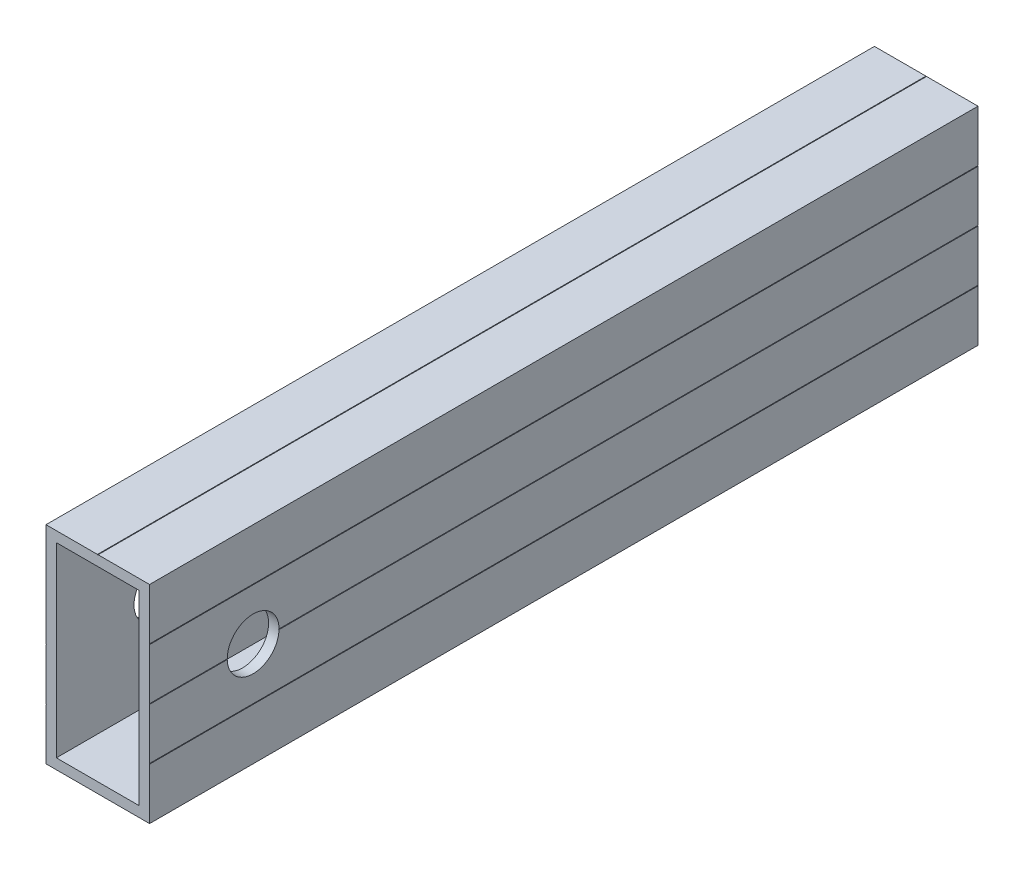
from build123d import *

# Parameters (mm, degrees)
SKETCH1_W           = 1498.6
SKETCH1_H           = 50.8
BOSS_EXTRUDE1_DEPTH = 25.4
CUT_EXTRUDE1_DEPTH  = 1498.6
CUT_EXTRUDE2_DEPTH  = 1499.869043646
CUT_EXTRUDE3_DEPTH  = 1498.6
CUT_EXTRUDE4_DEPTH  = 1498.6
CUT_EXTRUDE5_DEPTH  = 1499.869043646
CUT_EXTRUDE6_DEPTH  = 1499.869043646
CUT_EXTRUDE7_DEPTH  = 1498.6
CUT_EXTRUDE8_DEPTH  = 1498.6
SKETCH10_W          = 20.32
SKETCH10_H          = 45.72
CUT_EXTRUDE9_DEPTH  = 1499.869043646
DRAFT1_ANGLE        = 45
DRAFT2_ANGLE        = 45.000000005
DRAFT3_ANGLE        = 45
DRAFT4_ANGLE        = 45
DRAFT5_ANGLE        = 45
DRAFT6_ANGLE        = 44.999999995
SKETCH11_W          = 61.962293059
SKETCH11_H          = 88.678950317
CUT_EXTRUDE10_DEPTH = 1295.4
SKETCH13_R          = 6.35
CUT_EXTRUDE11_DEPTH = 25.4


with BuildPart() as part:
    # Sketch1 → Boss-Extrude1 (new body)
    with BuildSketch(Plane(origin=(12.7, 0, 0), x_dir=(0, 0, -1), z_dir=(1, 0, 0))):
        Rectangle(SKETCH1_W, SKETCH1_H)
    extrude(amount=-BOSS_EXTRUDE1_DEPTH)

    # Sketch2 → Cut-Extrude1 (cut)
    with BuildSketch(Plane.XY.offset(749.3)):
        Polygon((0.0762, 25.4), (-0.0762, 25.4), (0.0762, 25.2476), align=None)
    extrude(amount=-CUT_EXTRUDE1_DEPTH, mode=Mode.SUBTRACT)

    # Sketch3 → Cut-Extrude2 (cut, through all)
    with BuildSketch(Plane.XY.offset(749.3)):
        Polygon((12.7, 12.6238), (12.7, 12.7762), (12.5476, 12.7762), align=None)
    extrude(amount=-CUT_EXTRUDE2_DEPTH, mode=Mode.SUBTRACT)

    # Sketch4 → Cut-Extrude3 (cut)
    with BuildSketch(Plane.XY.offset(749.3)):
        Polygon((12.7, -0.0762), (12.7, 0.0762), (12.5476, -0.0762), align=None)
    extrude(amount=-CUT_EXTRUDE3_DEPTH, mode=Mode.SUBTRACT)

    # Sketch5 → Cut-Extrude4 (cut)
    with BuildSketch(Plane.XY.offset(749.3)):
        Polygon((12.7, -12.7762), (12.7, -12.6238), (12.5476, -12.6238), align=None)
    extrude(amount=-CUT_EXTRUDE4_DEPTH, mode=Mode.SUBTRACT)

    # Sketch6 → Cut-Extrude5 (cut, through all)
    with BuildSketch(Plane.XY.offset(749.3)):
        Polygon((0.0762, -25.4), (-0.0762, -25.2476), (-0.0762, -25.4), align=None)
    extrude(amount=-CUT_EXTRUDE5_DEPTH, mode=Mode.SUBTRACT)

    # Sketch7 → Cut-Extrude6 (cut, through all)
    with BuildSketch(Plane.XY.offset(749.3)):
        Polygon((-12.7, -12.6238), (-12.7, -12.7762), (-12.5476, -12.7762), align=None)
    extrude(amount=-CUT_EXTRUDE6_DEPTH, mode=Mode.SUBTRACT)

    # Sketch8 → Cut-Extrude7 (cut)
    with BuildSketch(Plane.XY.offset(749.3)):
        Polygon((-12.7, 0.0762), (-12.7, -0.0762), (-12.5476, 0.0762), align=None)
    extrude(amount=-CUT_EXTRUDE7_DEPTH, mode=Mode.SUBTRACT)

    # Sketch9 → Cut-Extrude8 (cut)
    with BuildSketch(Plane.XY.offset(749.3)):
        Polygon((-12.7, 12.7762), (-12.7, 12.6238), (-12.5476, 12.6238), align=None)
    extrude(amount=-CUT_EXTRUDE8_DEPTH, mode=Mode.SUBTRACT)

    # Sketch10 → Cut-Extrude9 (cut, through all)
    with BuildSketch(Plane.XY.offset(749.3)):
        Rectangle(SKETCH10_W, SKETCH10_H)
    extrude(amount=-CUT_EXTRUDE9_DEPTH, mode=Mode.SUBTRACT)

    # Draft1
    draft1_faces = [part.faces().sort_by_distance(p)[0] for p in [
        (0.0762, 25.3238, 0),
    ]]
    draft(draft1_faces, Plane(origin=(-12.7, 25.4, -749.3), x_dir=(0, 0, 1), z_dir=(0, 1, 0)), DRAFT1_ANGLE)

    # Draft2
    draft2_faces = [part.faces().sort_by_distance(p)[0] for p in [
        (12.6238, 12.7762, 0),
    ]]
    draft(draft2_faces, Plane(origin=(12.7, 0, 0), x_dir=(0, 0, 1), z_dir=(1, 0, 0)), DRAFT2_ANGLE)

    # Draft3
    draft3_faces = [part.faces().sort_by_distance(p)[0] for p in [
        (-0.0762, -25.3238, 0),
    ]]
    draft(draft3_faces, Plane(origin=(-12.7, -25.4, 749.3), x_dir=(0, 0, -1), z_dir=(0, -1, 0)), DRAFT3_ANGLE)

    # Draft4
    draft4_faces = [part.faces().sort_by_distance(p)[0] for p in [
        (-12.6238, -12.7762, 0),
    ]]
    draft(draft4_faces, Plane(origin=(-12.7, 0, 0), x_dir=(0, 0, -1), z_dir=(-1, 0, 0)), DRAFT4_ANGLE)

    # Draft5
    draft5_faces = [part.faces().sort_by_distance(p)[0] for p in [
        (12.6238, -12.6238, 0),
        (12.6238, 0, 0),
    ]]
    draft(draft5_faces, Plane(origin=(12.7, 0, 0), x_dir=(0, 0, 1), z_dir=(1, 0, 0)), DRAFT5_ANGLE)

    # Draft6
    draft6_faces = [part.faces().sort_by_distance(p)[0] for p in [
        (-12.6238, 0, 0),
        (-12.6238, 12.6238, 0),
    ]]
    draft(draft6_faces, Plane(origin=(-12.7, 0, 0), x_dir=(0, 0, -1), z_dir=(-1, 0, 0)), DRAFT6_ANGLE)

    # Sketch11 → Cut-Extrude10 (cut)
    with BuildSketch(Plane(origin=(0, 0, -749.3), x_dir=(-1, 0, 0), z_dir=(0, 0, -1))):
        with Locations((-2.92473676, 0.325700182)):
            Rectangle(SKETCH11_W, SKETCH11_H)
    extrude(amount=-CUT_EXTRUDE10_DEPTH, mode=Mode.SUBTRACT)

    # Sketch13 → Cut-Extrude11 (cut)
    with BuildSketch(Plane(origin=(12.7, 0, 0), x_dir=(0, 0, -1), z_dir=(1, 0, 0))):
        with Locations((-723.9, 0.0762)):
            Circle(SKETCH13_R)
    extrude(amount=-CUT_EXTRUDE11_DEPTH, mode=Mode.SUBTRACT)


solid = part.part
